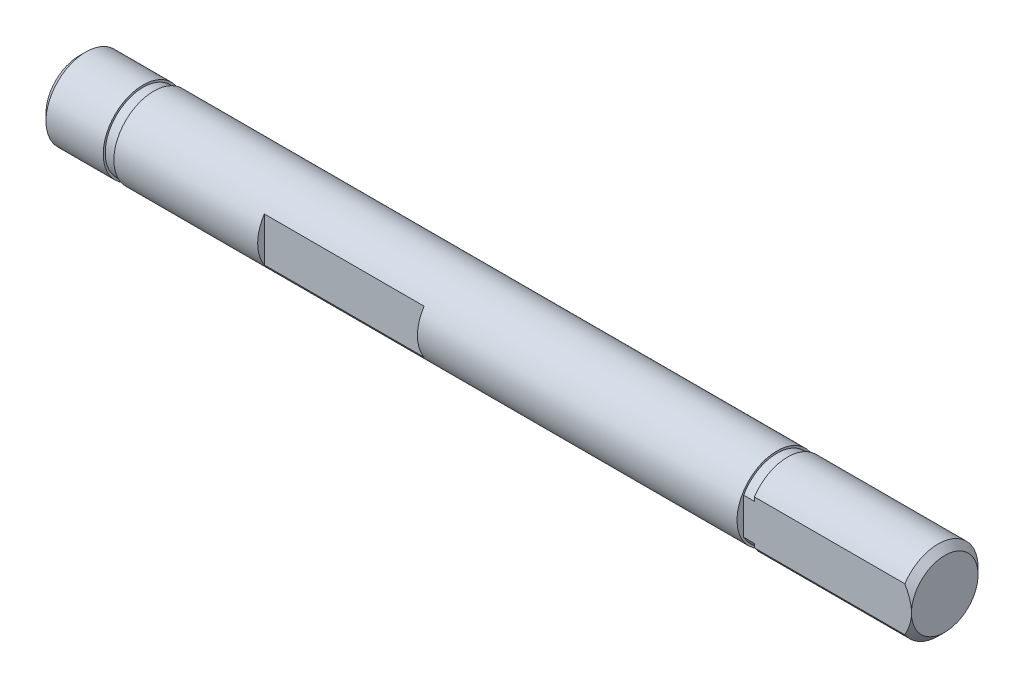
from build123d import *

# Parameters (mm, degrees)
CHAFL_N1_SIZE         = 0.5
CORTAR_EXTRUIR1_REACH = 67.138
CORTAR_EXTRUIR2_START = -48.6
CORTAR_EXTRUIR2_DEPTH = 12


with BuildPart() as part:
    # Croquis1 → Revolución1 (revolve)
    with BuildSketch(Plane(origin=(0, 0, 0), x_dir=(-1, 0, 0), z_dir=(0, 1, 0)), mode=Mode.PRIVATE) as revoluci_n1_sk:
        Polygon((-32.5, 0), (-32.5, 3), (-20.7, 3), (-20.7, 2.85), (-19.9, 2.85), (-19.9, 3), (26.9, 3), (26.9, 2.85), (27.7, 2.85), (27.7, 3), (32.5, 3), (32.5, 0), align=None)
    revolve(revoluci_n1_sk.sketch.rotate(Axis((32.5, 0, 0), (-1, 0, 0)), 180), axis=Axis((32.5, 0, 0), (-1, 0, 0)))

    # Chaflán1
    chafl_n1_edges = [part.edges().sort_by_distance(p)[0] for p in [
        (32.5, 0, 3),
        (-32.5, 0, 3),
    ]]
    chamfer(chafl_n1_edges, length=CHAFL_N1_SIZE)

    # Cortar-Extruir1: up to this face of the body (flat: up to its plane)
    cortar_extruir1_end = Plane(part.part.faces().sort_by_distance((19.9, 0, 2.934852814))[0])
    # Croquis2 → Cortar-Extruir1 (cut, up to the picked face)
    with BuildSketch(Plane.YZ.offset(32.5), mode=Mode.PRIVATE) as cortar_extruir1_sk1:
        with BuildLine():
            Line((1.658312395, 2.5), (-1.658312395, 2.5))
            ThreePointArc((-1.658312395, 2.5), (0, 3), (1.658312395, 2.5))
        make_face()
    cortar_extruir1_tool1 = split(extrude(cortar_extruir1_sk1.sketch, amount=-CORTAR_EXTRUIR1_REACH, mode=Mode.PRIVATE), bisect_by=cortar_extruir1_end, keep=Keep.BOTH, mode=Mode.PRIVATE)
    add(cortar_extruir1_tool1.solids().sort_by(Axis((32.5, 0, 2.701501), (-1, 0, 0)))[0], mode=Mode.SUBTRACT)

    # Croquis2<2> → Cortar-Extruir2 (cut)
    with BuildSketch(Plane.YZ.offset(32.5).offset(CORTAR_EXTRUIR2_START)):
        with BuildLine():
            Line((1.658312395, 2.5), (-1.658312395, 2.5))
            ThreePointArc((-1.658312395, 2.5), (0, 3), (1.658312395, 2.5))
        make_face()
    extrude(amount=CORTAR_EXTRUIR2_DEPTH, mode=Mode.SUBTRACT)


solid = part.part
